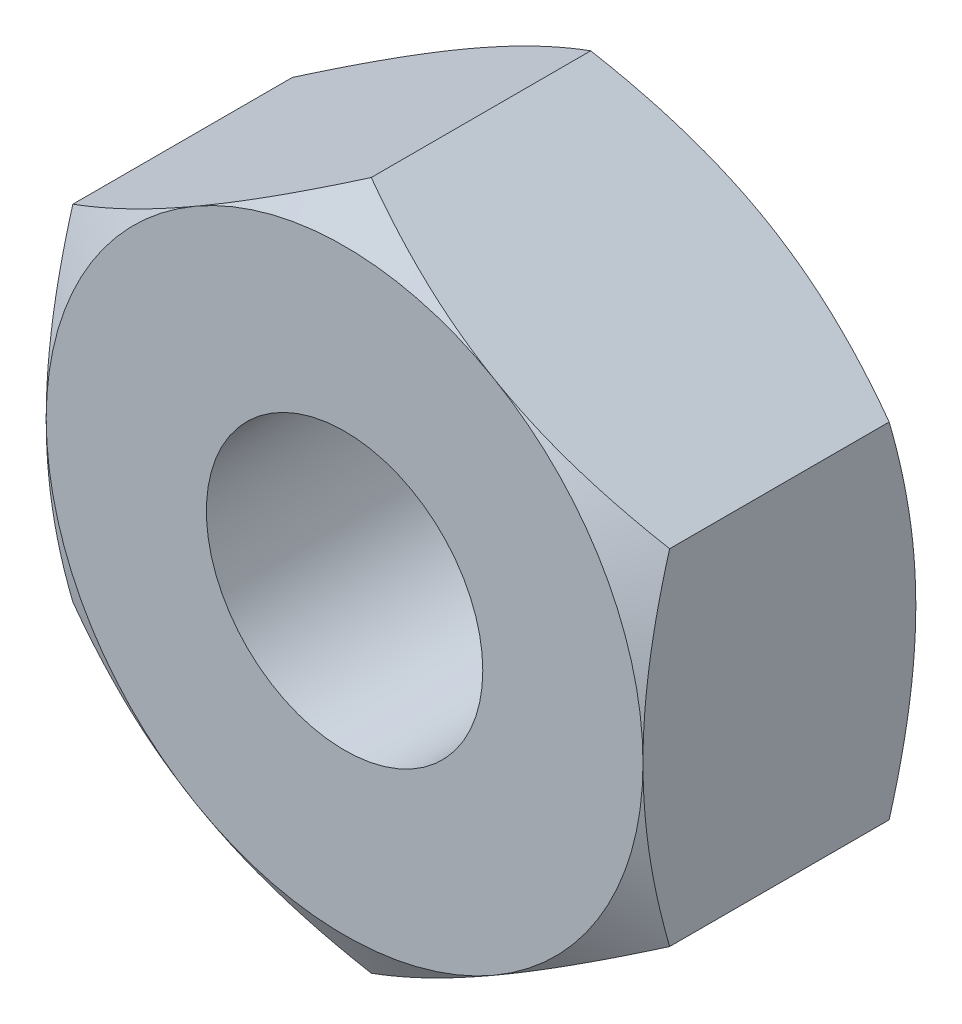
from build123d import *

# Parameters (mm, degrees)
SKETCH_1_R          = 1.621125
EXTRUDE_403_DEPTH   = 3.2
SKETCH_2_OUTSIDE_W  = 36.28
SKETCH_2_OUTSIDE_H  = 37.362
SKETCH_2_OUTSIDE_R  = 3.5
CUT_EXTRUDE_1_DEPTH = 7.23083729
CUT_EXTRUDE_1_DRAFT = -60
SKETCH_3_OUTSIDE_W  = 36.28
SKETCH_3_OUTSIDE_H  = 37.362
SKETCH_3_OUTSIDE_R  = 3.5
CUT_EXTRUDE_2_DEPTH = 7.23083729
CUT_EXTRUDE_2_DRAFT = -60


with BuildPart() as part:
    # 草图1 → Extrude 403 (new body)
    with BuildSketch(Plane.XY):
        Polygon((0, 4.041451884), (-3.5, 2.020725942), (-3.5, -2.020725942), (0, -4.041451884), (3.5, -2.020725942), (3.5, 2.020725942), align=None)
        Circle(SKETCH_1_R, mode=Mode.SUBTRACT)
    extrude(amount=EXTRUDE_403_DEPTH)


with BuildPart() as cut_extrude_1_tool:
    # 草图2 outside → 切除-拉伸1 (with draft: the straight prism first)
    with BuildSketch(Plane(origin=(0, 0, 0), x_dir=(-1, 0, 0), z_dir=(0, 0, -1))):
        Rectangle(SKETCH_2_OUTSIDE_W, SKETCH_2_OUTSIDE_H)
        Circle(SKETCH_2_OUTSIDE_R, mode=Mode.SUBTRACT)
    extrude(amount=-CUT_EXTRUDE_1_DEPTH)
    # 切除-拉伸1: the draft: its side faces are tilted about the plane it starts from
    cut_extrude_1_sides = [cut_extrude_1_tool.faces().sort_by_distance(p)[0] for p in [
        (0, -18.681, 3.615418645),
        (-18.14, 0, 3.615418645),
        (0, 18.681, 3.615418645),
        (18.14, 0, 3.615418645),
        (3.5, 0, 3.615418645),
    ]]
    draft(cut_extrude_1_sides, Plane(origin=(0, 0, 0), x_dir=(-1, 0, 0), z_dir=(0, 0, -1)), CUT_EXTRUDE_1_DRAFT)


with BuildPart() as part_1:
    add(part.part)

    # 切除-拉伸1: cut by cut_extrude_1_tool
    add(cut_extrude_1_tool.part, mode=Mode.SUBTRACT)


with BuildPart() as cut_extrude_2_tool:
    # 草图3 outside → 切除-拉伸2 (with draft: the straight prism first)
    with BuildSketch(Plane.XY.offset(3.2)):
        Rectangle(SKETCH_3_OUTSIDE_W, SKETCH_3_OUTSIDE_H)
        Circle(SKETCH_3_OUTSIDE_R, mode=Mode.SUBTRACT)
    extrude(amount=-CUT_EXTRUDE_2_DEPTH)
    # 切除-拉伸2: the draft: its side faces are tilted about the plane it starts from
    cut_extrude_2_sides = [cut_extrude_2_tool.faces().sort_by_distance(p)[0] for p in [
        (0, -18.681, -0.415418645),
        (18.14, 0, -0.415418645),
        (0, 18.681, -0.415418645),
        (-18.14, 0, -0.415418645),
        (-3.5, 0, -0.415418645),
    ]]
    draft(cut_extrude_2_sides, Plane.XY.offset(3.2), CUT_EXTRUDE_2_DRAFT)


with BuildPart() as part_2:
    add(part_1.part)

    # 切除-拉伸2: cut by cut_extrude_2_tool
    add(cut_extrude_2_tool.part, mode=Mode.SUBTRACT)


solid = part_2.part
